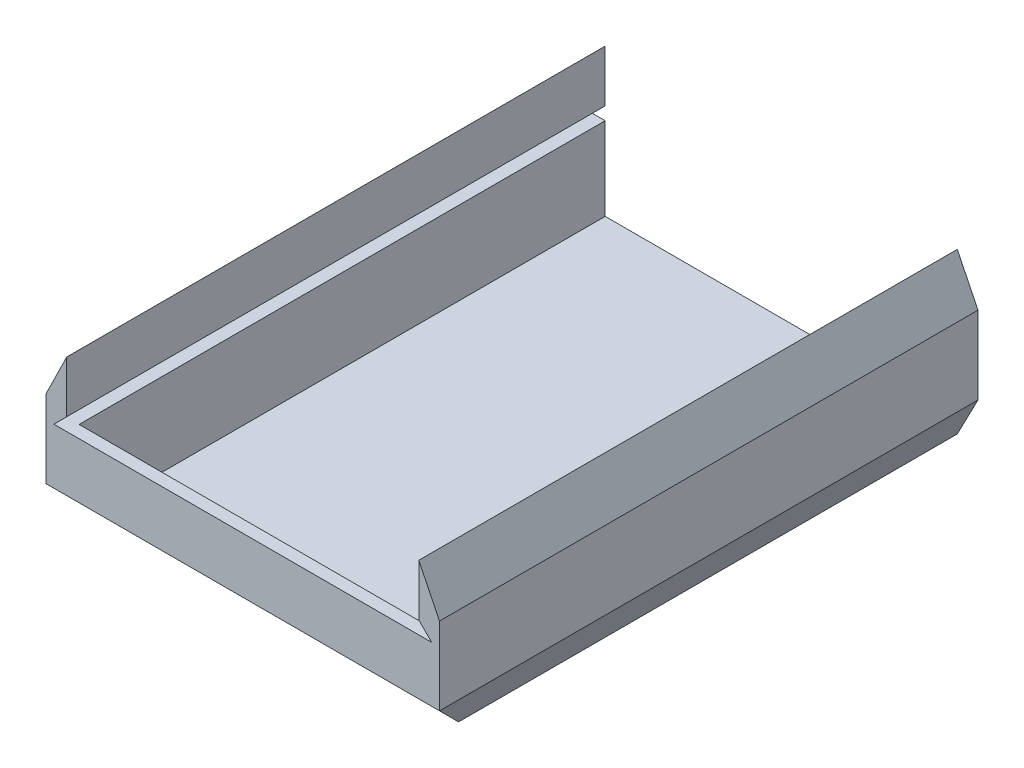
from build123d import *

# Parameters (mm, degrees)
SKETCH1_W                           = 85
SKETCH1_H                           = 130
BOSS_EXTRUDE1_BASE_DEPTH            = 3
BOSS_EXTRUDE4_SIDE_WALLS_DEPTH      = 130
CUT_EXTRUDE2_GUIDE_HOLES_DEPTH      = 163.616112363
SKETCH15_W                          = 85
SKETCH15_H                          = 20
BOSS_EXTRUDE9_FRONT_WALL_DEPTH      = 3
CHAMFER5_FRONT_CHAMFER_SIZE         = 9.61
CHAMFER6_FRONT_CHAMFER_CLEANUP_SIZE = 5
BOSS_EXTRUDE1_DEPTH                 = 130


with BuildPart() as part:
    # Sketch1 → Boss-Extrude1 _Base (new body)
    with BuildSketch(Plane(origin=(0, 0, 0), x_dir=(1, 0, 0), z_dir=(0, 1, 0))):
        with Locations((42.5, 65)):
            Rectangle(SKETCH1_W, SKETCH1_H)
    extrude(amount=BOSS_EXTRUDE1_BASE_DEPTH)

    # Sketch5 → Boss-Extrude4 _Side Walls (add, through all)
    with BuildSketch(Plane.XY):
        Polygon((-5, 28.390936655), (0, 38), (0, 0), (-5, 9.609063345), align=None)
        Polygon((90, 9.609063345), (90, 28.390936655), (85, 38), (85, 0), align=None)
    extrude(amount=-BOSS_EXTRUDE4_SIDE_WALLS_DEPTH)

    # Sketch4 → Cut-Extrude2 _Guide Holes (cut, through all)
    with BuildSketch(Plane.XY):
        Polygon((-3.1, 23), (0, 26.1), (0, 23), align=None)
        Polygon((85, 23), (88.1, 23), (85, 26.1), align=None)
    extrude(amount=-CUT_EXTRUDE2_GUIDE_HOLES_DEPTH, mode=Mode.SUBTRACT)

    # Sketch15 → Boss-Extrude9 _Front Wall (add)
    with BuildSketch(Plane.XY):
        with Locations((42.5, 13)):
            Rectangle(SKETCH15_W, SKETCH15_H)
    extrude(amount=-BOSS_EXTRUDE9_FRONT_WALL_DEPTH)

    # Chamfer5 _Front Chamfer
    chamfer5_front_chamfer_edges = [part.edges().sort_by_distance(p)[0] for p in [
        (42.5, 0, 0),
    ]]
    chamfer(chamfer5_front_chamfer_edges, length=CHAMFER5_FRONT_CHAMFER_SIZE)

    # Chamfer6 _Front Chamfer Cleanup
    chamfer6_front_chamfer_cleanup_edges = [part.edges().sort_by_distance(p)[0] for p in [
        (42.5, 3, -3),
    ]]
    chamfer(chamfer6_front_chamfer_cleanup_edges, length=CHAMFER6_FRONT_CHAMFER_CLEANUP_SIZE)

    # Sketch16 → Boss-Extrude1 (add, through all)
    with BuildSketch(Plane.XY):
        Polygon((0, 26.1), (0, 38.6), (-5, 28.390936655), align=None)
        Polygon((90, 28.390936655), (85, 26.1), (85, 38.6), align=None)
    extrude(amount=-BOSS_EXTRUDE1_DEPTH)


solid = part.part
